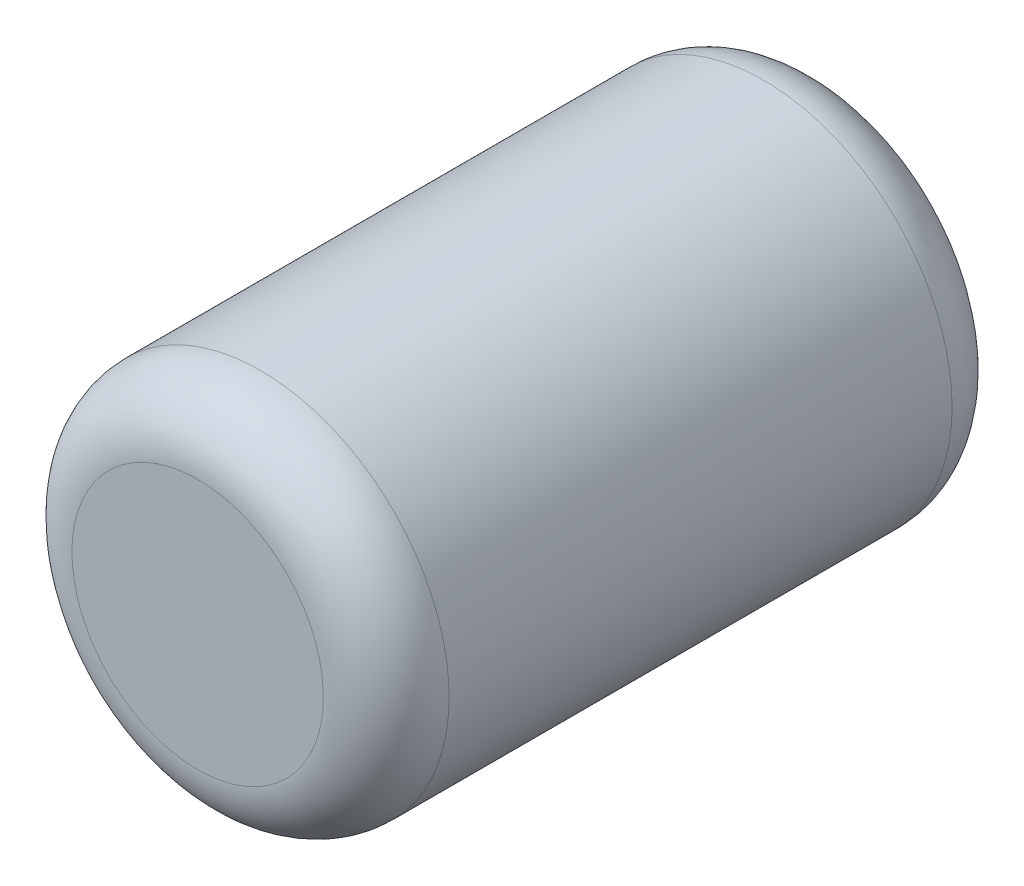
from build123d import *


with BuildPart() as part:
    # Эскиз2 → Повернуть1 (revolve)
    with BuildSketch(Plane(origin=(0, 0, 0), x_dir=(0, 0, -1), z_dir=(1, 0, 0)), mode=Mode.PRIVATE) as revolve_1_sk:
        with BuildLine():
            Line((0, 0), (-5, 0))
            Line((-5, 0), (-5, -1))
            ThreePointArc((-5, -1), (-4.853553391, -1.353553391), (-4.5, -1.5))
            Line((-4.5, -1.5), (-0.5, -1.5))
            ThreePointArc((-0.5, -1.5), (-0.146446609, -1.353553391), (0, -1))
            Line((0, -1), (0, 0))
        make_face()
    revolve(revolve_1_sk.sketch.rotate(Axis((0, 0, 0), (0, 0, 1)), 270), axis=Axis((0, 0, 0), (0, 0, 1)))


solid = part.part
